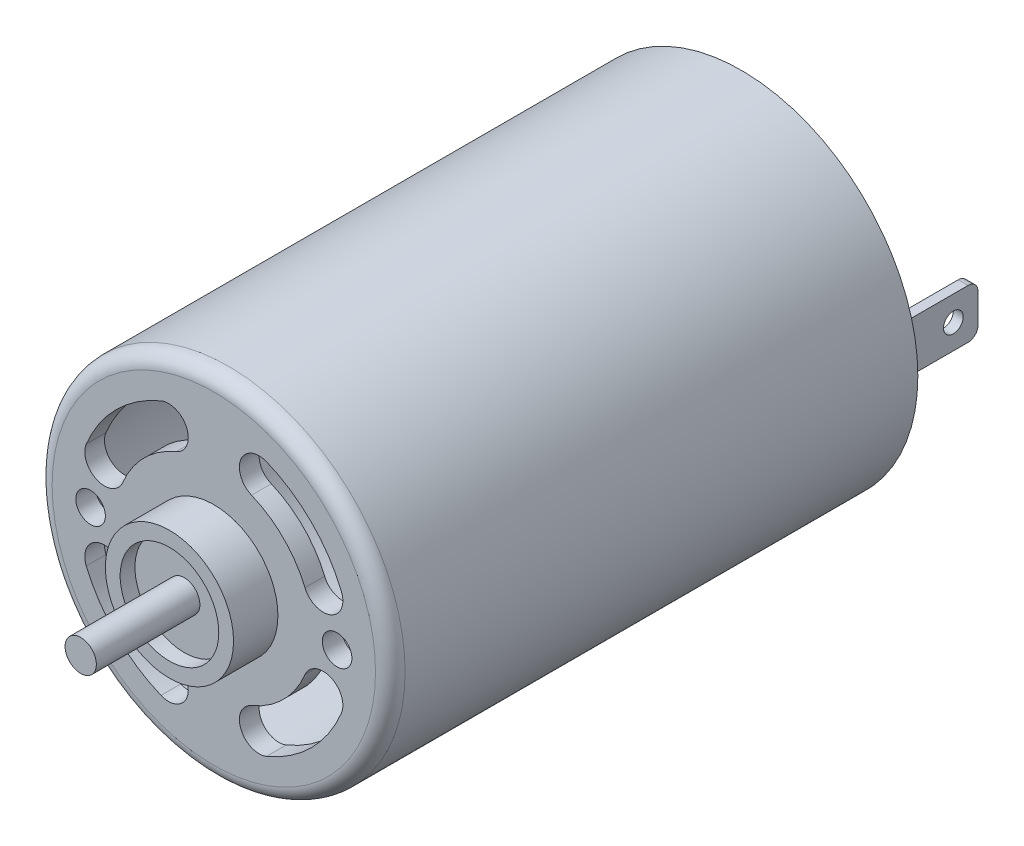
from build123d import *

# Parameters (mm, degrees)
SKETCH_1_R           = 17.9
EXTRUDE_1_DEPTH      = 53.5
SKETCH_2_R           = 6.5
EXTRUDE_2_DEPTH      = 4.5
SKETCH_2_3_R         = 1.5
CUT_EXTRUDE_1_DEPTH  = 10
SKETCH_5_R           = 1.585
EXTRUDE_3_DEPTH      = 9
CUT_EXTRUDE_START    = -1.5
SKETCH_5_3_R         = 5
SKETCH_5_3_R_2       = 1.585
CUT_EXTRUDE_2_DEPTH  = 1.5
CUT_EXTRUDE_3_DEPTH  = 5
SKETCH_8_R           = 16
CUT_EXTRUDE_4_DEPTH  = 48.5
SKETCH_1_5_R         = 7.5
EXTRUDE_5_DEPTH      = 4.5
SKETCH_1_7_R         = 17
SKETCH_1_7_R_2       = 12
SKETCH_1_7_W         = 1
SKETCH_1_7_H         = 5
CUT_EXTRUDE_6_DEPTH  = 2
SKETCH_1_8_W         = 1
SKETCH_1_8_H         = 5
EXTRUDE_6_DEPTH      = 9
FILLET_5_R           = 1
FILLET_9_R           = 1
FILLET_10_R          = 1.5
SKETCH_10_R          = 1
CUT_EXTRUDE_9_DEPTH  = 1
CUT_EXTRUDE_START_2  = -1
SKETCH_11_R          = 1
CUT_EXTRUDE_10_DEPTH = 1
FILLET_11_R          = 1
SKETCH_12_R          = 5.5
CUT_EXTRUDE_11_DEPTH = 2
EXTRUDE_START        = 8
SKETCH_13_R          = 1.585
EXTRUDE_7_DEPTH      = 8
FILLET_20_R          = 0.5


with BuildPart() as part:
    # Эскиз1 → Бобышка-Вытянуть1 (new body)
    with BuildSketch(Plane.XY):
        Circle(SKETCH_1_R)
    extrude(amount=EXTRUDE_1_DEPTH)

    # Эскиз2 → Бобышка-Вытянуть2 (add)
    with BuildSketch(Plane.XY.offset(53.5)):
        Circle(SKETCH_2_R)
    extrude(amount=EXTRUDE_2_DEPTH)

    # Эскиз2<3> → Вырез-Вытянуть1 (cut)
    with BuildSketch(Plane.XY.offset(53.5)):
        with Locations((12.5, 0)):
            Circle(SKETCH_2_3_R)
        with Locations((-12.5, 0)):
            Circle(SKETCH_2_3_R)
    extrude(amount=-CUT_EXTRUDE_1_DEPTH, mode=Mode.SUBTRACT)

    # Эскиз5 → Бобышка-Вытянуть3 (add)
    with BuildSketch(Plane.XY.offset(58)):
        Circle(SKETCH_5_R)
    extrude(amount=EXTRUDE_3_DEPTH)

    # Эскиз5<3> → Вырез-Вытянуть2 (cut)
    with BuildSketch(Plane.XY.offset(58).offset(CUT_EXTRUDE_START)):
        Circle(SKETCH_5_3_R)
        Circle(SKETCH_5_3_R_2, mode=Mode.SUBTRACT)
    extrude(amount=CUT_EXTRUDE_2_DEPTH, mode=Mode.SUBTRACT)

    # Эскиз2<4> → Вырез-Вытянуть3 (cut)
    with BuildSketch(Plane.XY.offset(53.5)):
        with BuildLine():
            ThreePointArc((-3.826834324, 9.238795325), (-7.071067812, 7.071067812), (-9.238795325, 3.826834324))
            ThreePointArc((-9.238795325, 3.826834324), (-11.851921255, 2.744442123), (-12.934313455, 5.357568053))
            ThreePointArc((-12.934313455, 5.357568053), (-9.899494937, 9.899494937), (-5.357568053, 12.934313455))
            ThreePointArc((-5.357568053, 12.934313455), (-2.744442123, 11.851921255), (-3.826834324, 9.238795325))
        make_face()
        with BuildLine():
            ThreePointArc((12.934313455, 5.357568053), (9.899494937, 9.899494937), (5.357568053, 12.934313455))
            ThreePointArc((5.357568053, 12.934313455), (2.744442123, 11.851921255), (3.826834324, 9.238795325))
            ThreePointArc((3.826834324, 9.238795325), (7.071067812, 7.071067812), (9.238795325, 3.826834324))
            ThreePointArc((9.238795325, 3.826834324), (11.851921255, 2.744442123), (12.934313455, 5.357568053))
        make_face()
        with BuildLine():
            ThreePointArc((12.934313455, -5.357568053), (11.851921255, -2.744442123), (9.238795325, -3.826834324))
            ThreePointArc((9.238795325, -3.826834324), (7.071067812, -7.071067812), (3.826834324, -9.238795325))
            ThreePointArc((3.826834324, -9.238795325), (2.744442123, -11.851921255), (5.357568053, -12.934313455))
            ThreePointArc((5.357568053, -12.934313455), (9.899494937, -9.899494937), (12.934313455, -5.357568053))
        make_face()
        with BuildLine():
            ThreePointArc((-5.357568053, -12.934313455), (-2.744442123, -11.851921255), (-3.826834324, -9.238795325))
            ThreePointArc((-3.826834324, -9.238795325), (-7.071067812, -7.071067812), (-9.238795325, -3.826834324))
            ThreePointArc((-9.238795325, -3.826834324), (-11.851921255, -2.744442123), (-12.934313455, -5.357568053))
            ThreePointArc((-12.934313455, -5.357568053), (-9.899494937, -9.899494937), (-5.357568053, -12.934313455))
        make_face()
    extrude(amount=-CUT_EXTRUDE_3_DEPTH, mode=Mode.SUBTRACT)

    # Эскиз8 → Вырез-Вытянуть4 (cut)
    with BuildSketch(Plane.XY.offset(3)):
        with Locations(Location((0, 0, 0), (0, 0, 180))):
            Circle(SKETCH_8_R)
    extrude(amount=CUT_EXTRUDE_4_DEPTH, mode=Mode.SUBTRACT)

    # Эскиз1<5> → Бобышка-Вытянуть5 (add)
    with BuildSketch(Plane.XY):
        Circle(SKETCH_1_5_R)
    extrude(amount=-EXTRUDE_5_DEPTH)

    # Эскиз1<7> → Вырез-Вытянуть6 (cut)
    with BuildSketch(Plane.XY):
        Circle(SKETCH_1_7_R)
        Circle(SKETCH_1_7_R_2, mode=Mode.SUBTRACT)
        with Locations((-14.5, 0)):
            Rectangle(SKETCH_1_7_W, SKETCH_1_7_H, mode=Mode.SUBTRACT)
        with Locations((14.5, 0)):
            Rectangle(SKETCH_1_7_W, SKETCH_1_7_H, mode=Mode.SUBTRACT)
    extrude(amount=CUT_EXTRUDE_6_DEPTH, mode=Mode.SUBTRACT)

    # Эскиз1<8> → Бобышка-Вытянуть6 (add)
    with BuildSketch(Plane.XY):
        with Locations((14.5, 0)):
            Rectangle(SKETCH_1_8_W, SKETCH_1_8_H)
        with Locations((-14.5, 0)):
            Rectangle(SKETCH_1_8_W, SKETCH_1_8_H)
    extrude(amount=-EXTRUDE_6_DEPTH)

    # Скругление5
    fillet_5_edges = [part.edges().sort_by_distance(p)[0] for p in [
        (-12, 0, 0),
    ]]
    fillet(fillet_5_edges, radius=FILLET_5_R)

    # Скругление9
    fillet_9_edges = [part.edges().sort_by_distance(p)[0] for p in [
        (-7.5, 0, -4.5),
    ]]
    fillet(fillet_9_edges, radius=FILLET_9_R)

    # Скругление10
    fillet_10_edges = [part.edges().sort_by_distance(p)[0] for p in [
        (-17.9, 0, 53.5),
    ]]
    fillet(fillet_10_edges, radius=FILLET_10_R)

    # Эскиз10 → Вырез-Вытянуть9 (cut)
    with BuildSketch(Plane(origin=(15, 0, 0), x_dir=(0, 0, -1), z_dir=(1, 0, 0))):
        with Locations(Location((6.5, 0, 0), (0, 0, 90))):
            Circle(SKETCH_10_R)
    extrude(amount=-CUT_EXTRUDE_9_DEPTH, mode=Mode.SUBTRACT)

    # Эскиз11 → Вырез-Вытянуть10 (cut)
    with BuildSketch(Plane.ZY.offset(15).offset(CUT_EXTRUDE_START_2)):
        with Locations(Location((-6.5, 0, 0), (0, 0, 90))):
            Circle(SKETCH_11_R)
    extrude(amount=CUT_EXTRUDE_10_DEPTH, mode=Mode.SUBTRACT)

    # Скругление11
    fillet_11_edges = [part.edges().sort_by_distance(p)[0] for p in [
        (-14.5, -2.5, -9),
        (-14.5, 2.5, -9),
        (14.5, 2.5, -9),
        (14.5, -2.5, -9),
    ]]
    fillet(fillet_11_edges, radius=FILLET_11_R)

    # Эскиз12 → Вырез-Вытянуть11 (cut)
    with BuildSketch(Plane(origin=(0, 0, -4.5), x_dir=(-1, 0, 0), z_dir=(0, 0, -1))):
        Circle(SKETCH_12_R)
    extrude(amount=-CUT_EXTRUDE_11_DEPTH, mode=Mode.SUBTRACT)

    # Эскиз13 → Бобышка-Вытянуть7 (add)
    with BuildSketch(Plane(origin=(0, 0, -2.5), x_dir=(-1, 0, 0), z_dir=(0, 0, -1)).offset(EXTRUDE_START)):
        with Locations(Location((0, 0, 0), (0, 0, 180))):
            Circle(SKETCH_13_R)
    extrude(amount=-EXTRUDE_7_DEPTH)

    # Скругление20
    fillet_20_edges = [part.edges().sort_by_distance(p)[0] for p in [
        (-1.585, 0, -10.5),
    ]]
    fillet(fillet_20_edges, radius=FILLET_20_R)


solid = part.part
